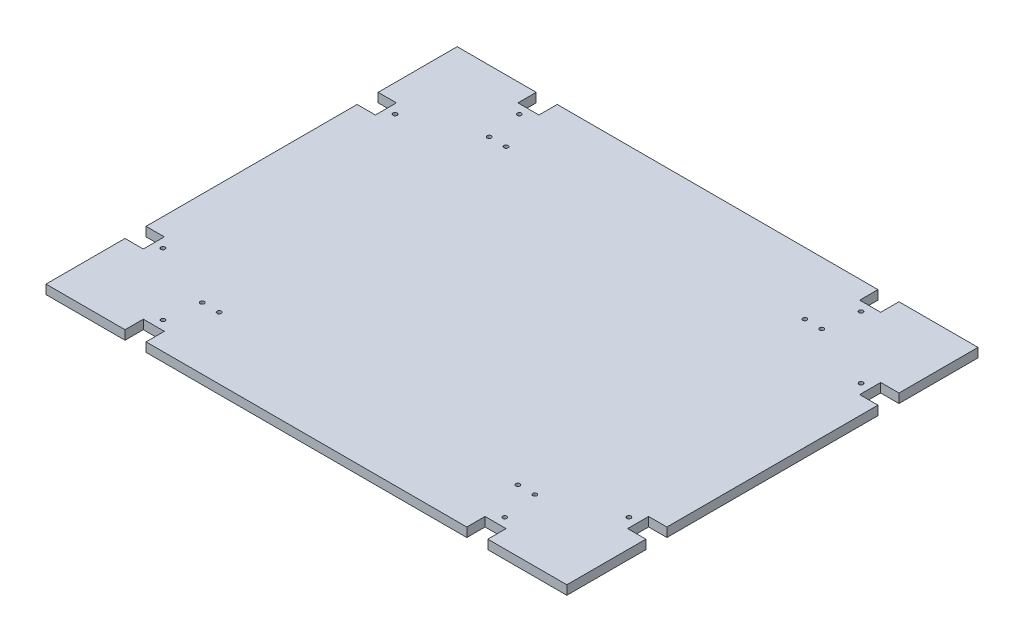
from build123d import *

# Parameters (mm, degrees)
SCHIZZO1_W                   = 570
SCHIZZO1_H                   = 450
ESTRUSIONE_ESTRUSIONE1_DEPTH = 10
SCHIZZO2_R                   = 2.25
SCHIZZO2_W                   = 23
SCHIZZO2_H                   = 20
SCHIZZO2_W_2                 = 20
SCHIZZO2_H_2                 = 23
TAGLIO_ESTRUSIONE1_DEPTH     = 10


with BuildPart() as part:
    # Schizzo1 → Estrusione-Estrusione1 (new body)
    with BuildSketch(Plane(origin=(0, 0, 0), x_dir=(1, 0, 0), z_dir=(0, 1, 0))):
        with Locations((-285, 225)):
            Rectangle(SCHIZZO1_W, SCHIZZO1_H)
    extrude(amount=ESTRUSIONE_ESTRUSIONE1_DEPTH)

    # Schizzo2 → Taglio-Estrusione1 (cut)
    with BuildSketch(Plane.XZ):
        with Locations(Location((-467, -68, 0), (0, 0, 270))):
            Circle(SCHIZZO2_R)
        with Locations(Location((-448.5, -68, 0), (0, 0, 270))):
            Circle(SCHIZZO2_R)
        with Locations(Location((-121.5, -68, 0), (0, 0, 270))):
            Circle(SCHIZZO2_R)
        with Locations(Location((-103, -68, 0), (0, 0, 270))):
            Circle(SCHIZZO2_R)
        with Locations(Location((-467, -382, 0), (0, 0, 270))):
            Circle(SCHIZZO2_R)
        with Locations(Location((-448.5, -382, 0), (0, 0, 270))):
            Circle(SCHIZZO2_R)
        with Locations(Location((-121.5, -382, 0), (0, 0, 270))):
            Circle(SCHIZZO2_R)
        with Locations(Location((-103, -382, 0), (0, 0, 270))):
            Circle(SCHIZZO2_R)
        with Locations(Location((-472, -420, 0), (0, 0, 270))):
            Circle(SCHIZZO2_R)
        with Locations(Location((-540, -352, 0), (0, 0, 270))):
            Circle(SCHIZZO2_R)
        with Locations(Location((-540, -98, 0), (0, 0, 270))):
            Circle(SCHIZZO2_R)
        with Locations(Location((-472, -30, 0), (0, 0, 270))):
            Circle(SCHIZZO2_R)
        with Locations(Location((-98, -30, 0), (0, 0, 270))):
            Circle(SCHIZZO2_R)
        with Locations(Location((-30, -98, 0), (0, 0, 270))):
            Circle(SCHIZZO2_R)
        with Locations(Location((-30, -352, 0), (0, 0, 270))):
            Circle(SCHIZZO2_R)
        with Locations(Location((-98, -420, 0), (0, 0, 270))):
            Circle(SCHIZZO2_R)
        with Locations((-472, -10)):
            Rectangle(SCHIZZO2_W, SCHIZZO2_H)
        with Locations((-98, -10)):
            Rectangle(SCHIZZO2_W, SCHIZZO2_H)
        with Locations((-10, -98)):
            Rectangle(SCHIZZO2_W_2, SCHIZZO2_H_2)
        with Locations((-10, -352)):
            Rectangle(SCHIZZO2_W_2, SCHIZZO2_H_2)
        with Locations((-98, -440)):
            Rectangle(SCHIZZO2_W, SCHIZZO2_H)
        with Locations((-472, -440)):
            Rectangle(SCHIZZO2_W, SCHIZZO2_H)
        with Locations((-560, -352)):
            Rectangle(SCHIZZO2_W_2, SCHIZZO2_H_2)
        with Locations((-560, -98)):
            Rectangle(SCHIZZO2_W_2, SCHIZZO2_H_2)
    extrude(amount=-TAGLIO_ESTRUSIONE1_DEPTH, mode=Mode.SUBTRACT)


solid = part.part
